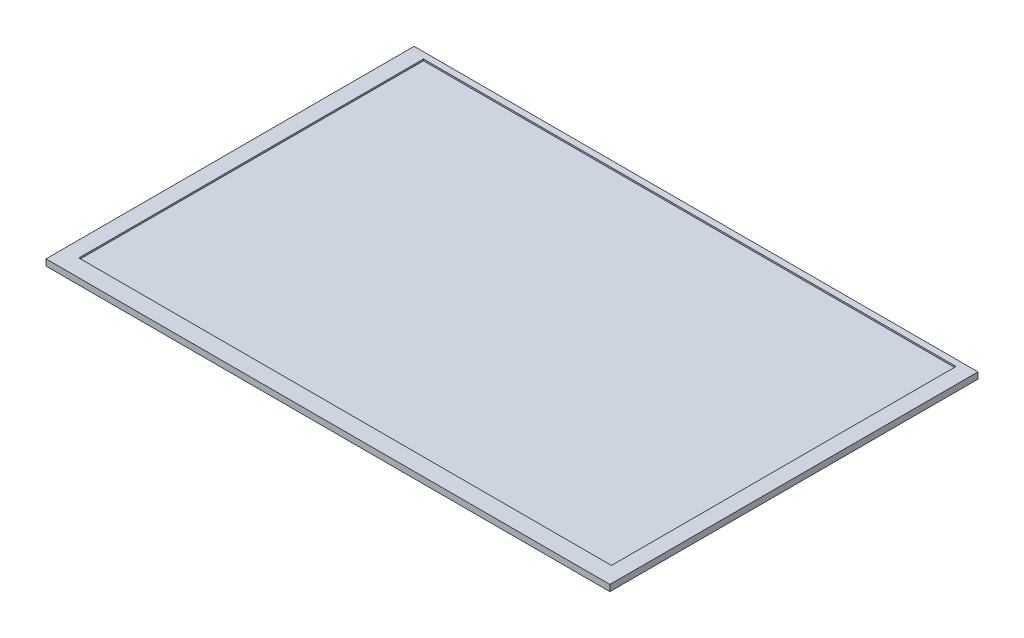
from build123d import *

# Parameters (mm, degrees)
SKETCH1_W           = 228.6
SKETCH1_H           = 149.225
BOSS_EXTRUDE1_DEPTH = 2.54
SKETCH2_W           = 215.9
SKETCH2_H           = 139.7
CUT_EXTRUDE1_DEPTH  = 0.635


with BuildPart() as part:
    # Sketch1 → Boss-Extrude1 (new body)
    with BuildSketch(Plane(origin=(0, 0, 0), x_dir=(1, 0, 0), z_dir=(0, 1, 0))):
        Rectangle(SKETCH1_W, SKETCH1_H)
    extrude(amount=BOSS_EXTRUDE1_DEPTH)

    # Sketch2 → Cut-Extrude1 (cut)
    with BuildSketch(Plane(origin=(0, 2.54, 0), x_dir=(1, 0, 0), z_dir=(0, 1, 0))):
        with Locations((0, 2.2225)):
            Rectangle(SKETCH2_W, SKETCH2_H)
    extrude(amount=-CUT_EXTRUDE1_DEPTH, mode=Mode.SUBTRACT)


solid = part.part
